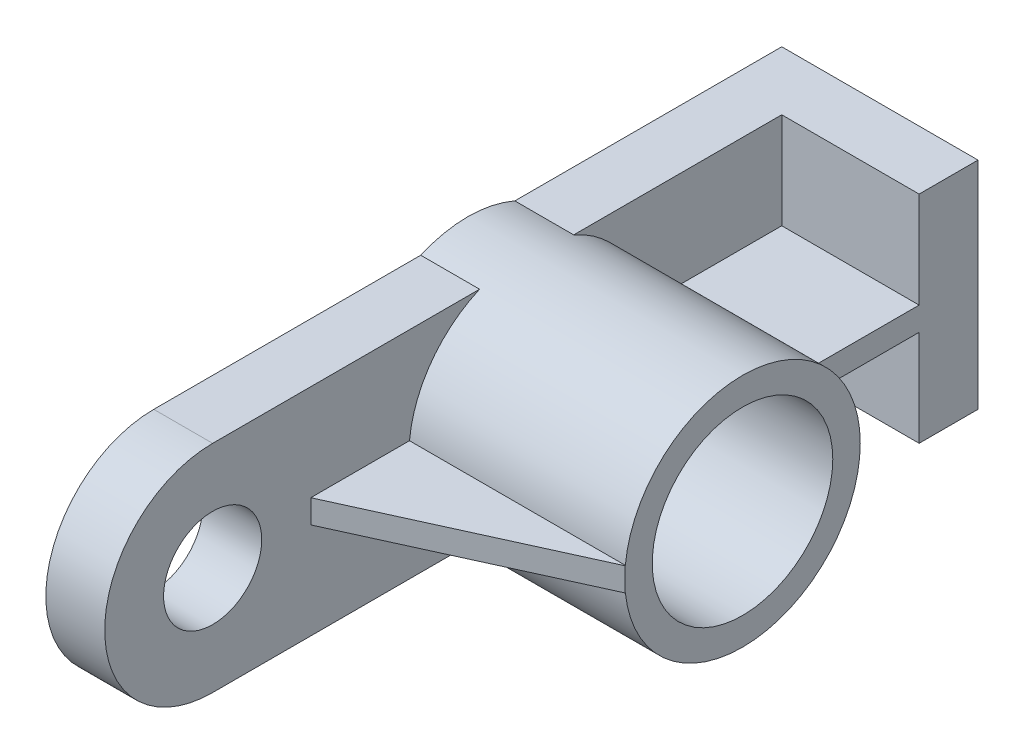
from build123d import *

# Parameters (mm, degrees)
BOSS_EXTRUDE1_DEPTH      = 15
BOSS_EXTRUDE2_DEPTH      = 55
BOSS_EXTRUDE2_DEPTH_BACK = 15
SKETCH2_R                = 30
HOLE1_D                  = 46
SKETCH5_W                = 50
SKETCH5_H                = 55
BOSS_EXTRUDE3_DEPTH      = 15
RIB1_REACH               = 133.743
SKETCH6_WALL_W           = 300.486242526
SKETCH6_WALL_H           = 6
BOSS_EXTRUDE5_DEPTH      = 3
HOLE2_D                  = 25


with BuildPart() as part:
    # Sketch1 → Boss-Extrude1 (new body)
    with BuildSketch(Plane(origin=(0, 0, 0), x_dir=(0, 0, -1), z_dir=(1, 0, 0))):
        with BuildLine():
            Line((-80, 27.5), (80, 27.5))
            Line((80, 27.5), (80, -27.5))
            Line((80, -27.5), (-80, -27.5))
            ThreePointArc((-80, -27.5), (-107.5, 0), (-80, 27.5))
        make_face()
    extrude(amount=BOSS_EXTRUDE1_DEPTH)

    # Sketch2 → Boss-Extrude2 (add, two sides: drawn at the far end of the back side and taken through both)
    with BuildSketch(Plane(origin=(15, 0, 0), x_dir=(0, 0, -1), z_dir=(1, 0, 0)).offset(-BOSS_EXTRUDE2_DEPTH_BACK)):
        Circle(SKETCH2_R)
    extrude(amount=BOSS_EXTRUDE2_DEPTH + BOSS_EXTRUDE2_DEPTH_BACK)

    # Hole1 (through all)
    with Locations(Plane(origin=(70, 0, 0), x_dir=(0, 0, -1), z_dir=(1, 0, 0))):
        with Locations((0, 0)):
            Hole(HOLE1_D / 2)

    # Sketch5 → Boss-Extrude3 (add)
    with BuildSketch(Plane(origin=(0, 0, -80), x_dir=(-1, 0, 0), z_dir=(0, 0, -1))):
        with Locations((-25, 0)):
            Rectangle(SKETCH5_W, SKETCH5_H)
    extrude(amount=-BOSS_EXTRUDE3_DEPTH)

    # Sketch6 wall → Rib1 (add, up to next)
    with BuildSketch(Plane(origin=(50, 0, -47.5), x_dir=(0, 0, 1), z_dir=(1, 0, 0)), mode=Mode.PRIVATE) as rib1_sk1:
        Rectangle(SKETCH6_WALL_W, SKETCH6_WALL_H)
    rib1_tool1 = extrude(rib1_sk1.sketch, amount=-RIB1_REACH, mode=Mode.PRIVATE) - part.part
    add(rib1_tool1.solids().sort_by_distance((50, 0, -47.5))[0])

    # Sketch7 → Boss-Extrude5 (add, symmetric)
    with BuildSketch(Plane(origin=(0, 0, 0), x_dir=(1, 0, 0), z_dir=(0, 1, 0))):
        Polygon((70, -30), (15, -55), (15, -28), (70, -28), align=None)
    extrude(amount=BOSS_EXTRUDE5_DEPTH, both=True)

    # Hole2 (through all)
    with Locations(Plane(origin=(15, 0, 0), x_dir=(0, 0, -1), z_dir=(1, 0, 0))):
        with Locations((-80, 0)):
            Hole(HOLE2_D / 2)


solid = part.part
